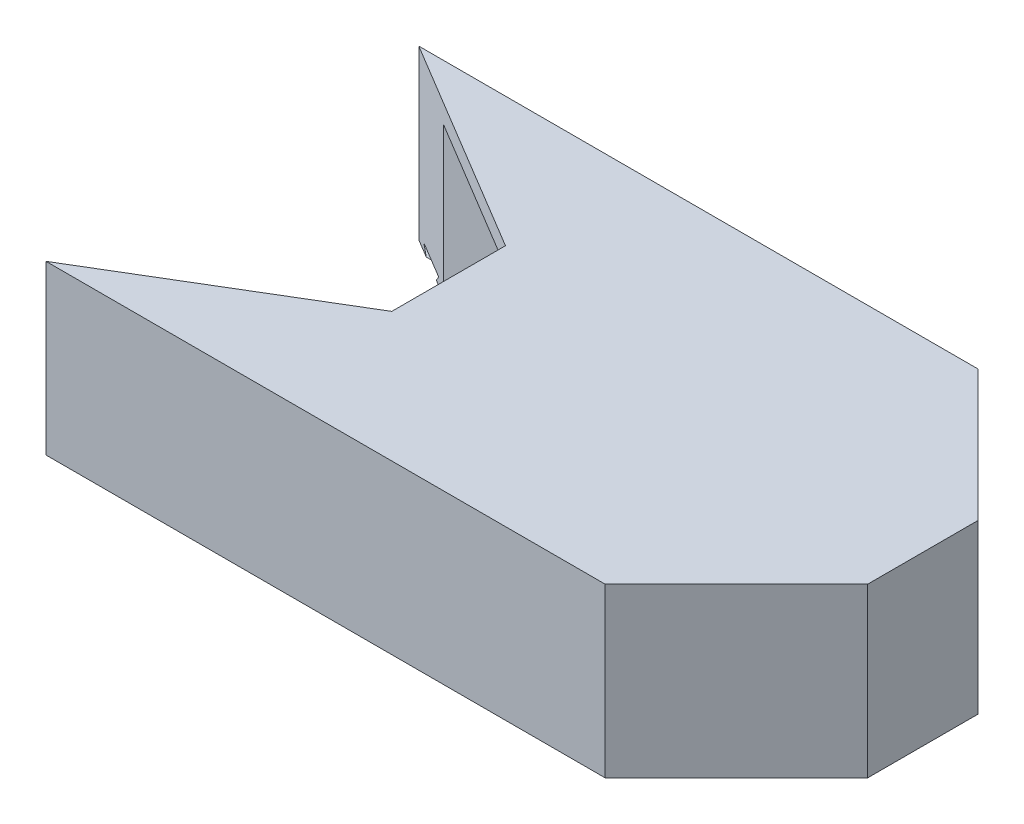
from build123d import *

# Parameters (mm, degrees)
BOSS_EXTRUDE1_DEPTH     = 45
SKETCH2_W               = 40
SKETCH2_H               = 20.5
CUT_EXTRUDE1_DEPTH      = 41
SKETCH3_W               = 8.5
SKETCH3_H               = 20.5
SKETCH3_R               = 1.5
CUT_EXTRUDE2_DEPTH      = 14
SKETCH3_3_R             = 1.5
CUT_EXTRUDE3_DEPTH      = 19
CUT_EXTRUDE4_DEPTH      = 87
CUT_EXTRUDE5_DEPTH      = 198.034718556
CUT_EXTRUDE5_DEPTH_BACK = 40
CUT_EXTRUDE6_DEPTH      = 146


with BuildPart() as part:
    # Sketch1 → Boss-Extrude1 (new body)
    with BuildSketch(Plane(origin=(0, 0, 0), x_dir=(1, 0, 0), z_dir=(0, 1, 0))):
        with BuildLine():
            Line((150, 50), (0, 50))
            ThreePointArc((0, 50), (-50, 0), (0, -50))
            Line((0, -50), (150, -50))
            Line((150, -50), (185.196329112, -14.803670888))
            Line((185.196329112, -14.803670888), (185.196329112, 14.803670888))
            Line((185.196329112, 14.803670888), (150, 50))
        make_face()
    extrude(amount=-BOSS_EXTRUDE1_DEPTH)

    # Sketch2 → Cut-Extrude1 (cut)
    with BuildSketch(Plane(origin=(0, 0, 0), x_dir=(1, 0, 0), z_dir=(0, 1, 0))):
        with Locations((24.5, 0)):
            Rectangle(SKETCH2_W, SKETCH2_H)
    extrude(amount=-CUT_EXTRUDE1_DEPTH, mode=Mode.SUBTRACT)

    # Sketch3 → Cut-Extrude2 (cut)
    # profile 1 of 2: a face of its own
    with BuildSketch(Plane(origin=(0, 0, 0), x_dir=(1, 0, 0), z_dir=(0, 1, 0))):
        with Locations((48.75, 0)):
            Rectangle(SKETCH3_W, SKETCH3_H)
        with Locations((48.5, -5)):
            Circle(SKETCH3_R, mode=Mode.SUBTRACT)
        with Locations((48.5, 5)):
            Circle(SKETCH3_R, mode=Mode.SUBTRACT)
    # profile 2 of 2: a face of its own
    with BuildSketch(Plane(origin=(0, 0, 0), x_dir=(1, 0, 0), z_dir=(0, 1, 0))):
        with Locations((0.25, 0)):
            Rectangle(SKETCH3_W, SKETCH3_H)
        with Locations((0.5, -5)):
            Circle(SKETCH3_R, mode=Mode.SUBTRACT)
        with Locations((0.5, 5)):
            Circle(SKETCH3_R, mode=Mode.SUBTRACT)
    extrude(amount=-CUT_EXTRUDE2_DEPTH, mode=Mode.SUBTRACT)

    # Sketch3<3> → Cut-Extrude3 (cut)
    with BuildSketch(Plane(origin=(0, 0, 0), x_dir=(1, 0, 0), z_dir=(0, 1, 0))):
        with Locations((0.5, 5)):
            Circle(SKETCH3_3_R)
        with Locations((0.5, -5)):
            Circle(SKETCH3_3_R)
        with Locations((48.5, -5)):
            Circle(SKETCH3_3_R)
        with Locations((48.5, 5)):
            Circle(SKETCH3_3_R)
    extrude(amount=-CUT_EXTRUDE3_DEPTH, mode=Mode.SUBTRACT)

    # Sketch3<4> → Cut-Extrude4 (cut)
    with BuildSketch(Plane(origin=(0, 0, 0), x_dir=(1, 0, 0), z_dir=(0, 1, 0))):
        with BuildLine():
            Line((58, -15.25), (58, 15.25))
            Line((58, 15.25), (0, 50))
            ThreePointArc((0, 50), (-50, 0), (0, -50))
            Line((0, -50), (58, -15.25))
        make_face()
    extrude(amount=-CUT_EXTRUDE4_DEPTH, mode=Mode.SUBTRACT)

    # Sketch5 → Cut-Extrude5 (cut, two sides: drawn at the far end of the back side and taken through both)
    with BuildSketch(Plane.XZ.offset(45).offset(-CUT_EXTRUDE5_DEPTH_BACK)):
        Polygon((36.14772109, 40), (16.690647482, 40), (58, 15.25), (58, -15.25), (16.690647482, -40), (36.14772109, -40), (145.857864376, -40), (175.196329112, -10.661535265), (175.196329112, 10.661535265), (145.857864376, 40), align=None)
    extrude(amount=CUT_EXTRUDE5_DEPTH + CUT_EXTRUDE5_DEPTH_BACK, mode=Mode.SUBTRACT)

    # Sketch6 → Cut-Extrude6 (cut)
    with BuildSketch(Plane.ZY):
        Polygon((43, -45), (47, -45), (48, -43), (42, -43), align=None)
    cut_extrude6 = extrude(amount=-CUT_EXTRUDE6_DEPTH, mode=Mode.SUBTRACT)

    # Mirror1: Cut-Extrude6 across plane
    add(cut_extrude6.mirror(Plane.XY), mode=Mode.SUBTRACT)


solid = part.part
